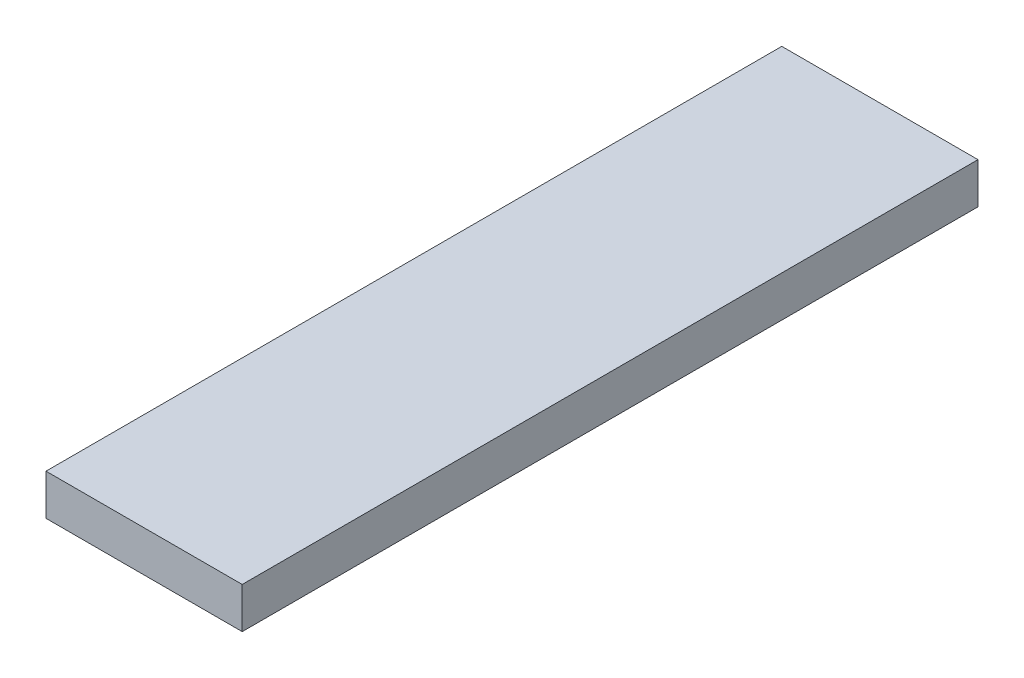
from build123d import *

# Parameters (mm, degrees)
SKETCH1_W           = 15.24
SKETCH1_H           = 57.15
BOSS_EXTRUDE1_DEPTH = 3.175


with BuildPart() as part:
    # Sketch1 → Boss-Extrude1 (new body)
    with BuildSketch(Plane(origin=(0, 0, 0), x_dir=(1, 0, 0), z_dir=(0, 1, 0))):
        with Locations((0, 28.575)):
            Rectangle(SKETCH1_W, SKETCH1_H)
    extrude(amount=BOSS_EXTRUDE1_DEPTH)


solid = part.part
